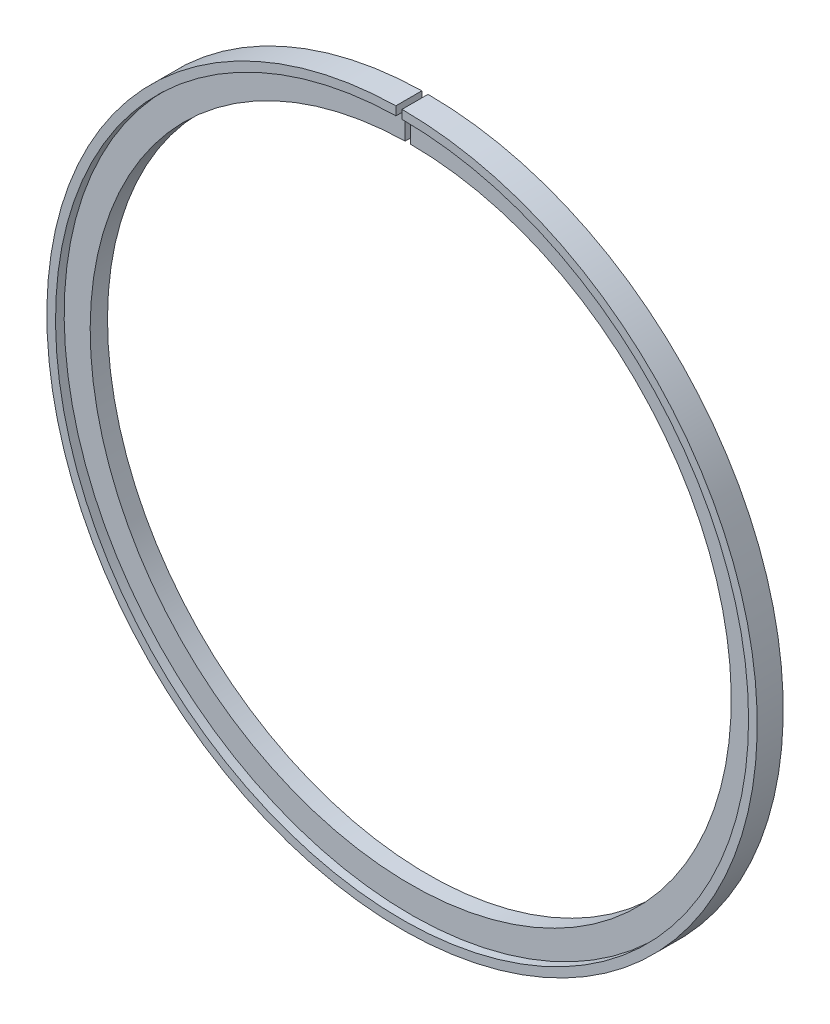
from build123d import *

# Parameters (mm, degrees)
EXTRUDE_1_DEPTH = 2
EXTRUDE_3_DEPTH = 1


with BuildPart() as part:
    # 草图1 → 凸台-拉伸1 (new body)
    with BuildSketch(Plane.XY):
        with BuildLine():
            Line((-0.645739038, 36.994364721), (-0.715548664, 40.993755501))
            ThreePointArc((-0.715548664, 40.993755501), (0.357787955, -40.998438846), (0, 41))
            Line((0, 41), (0, 37))
            ThreePointArc((0, 37), (0.322881813, -36.998591153), (-0.645739038, 36.994364721))
        make_face()
    extrude(amount=EXTRUDE_1_DEPTH)

    # 草图2 → 凸台-拉伸3 (add)
    with BuildSketch(Plane.XY.offset(2)):
        with BuildLine():
            Line((-0.698096257, 39.993907806), (-0.715548664, 40.993755501))
            ThreePointArc((-0.715548664, 40.993755501), (0.357787955, -40.998438846), (0, 41))
            Line((0, 41), (0, 40))
            ThreePointArc((0, 40), (0.34906142, -39.998476923), (-0.698096257, 39.993907806))
        make_face()
    extrude(amount=EXTRUDE_3_DEPTH)


solid = part.part
